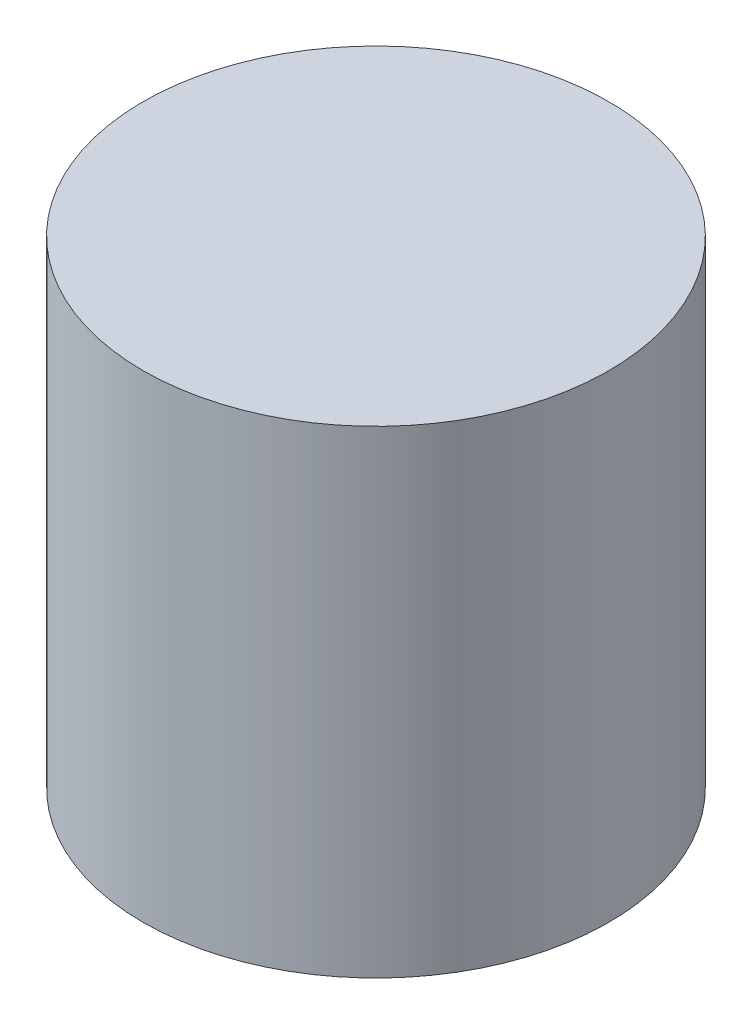
from build123d import *

# Parameters (mm, degrees)
SKETCH1_R           = 49.53
BOSS_EXTRUDE1_DEPTH = 101.6


with BuildPart() as part:
    # Sketch1 → Boss-Extrude1 (new body)
    with BuildSketch(Plane(origin=(0, 0, 0), x_dir=(1, 0, 0), z_dir=(0, 1, 0))):
        with Locations(Location((0, 0, 0), (0, 0, 270))):
            Circle(SKETCH1_R)
    extrude(amount=BOSS_EXTRUDE1_DEPTH)


solid = part.part
